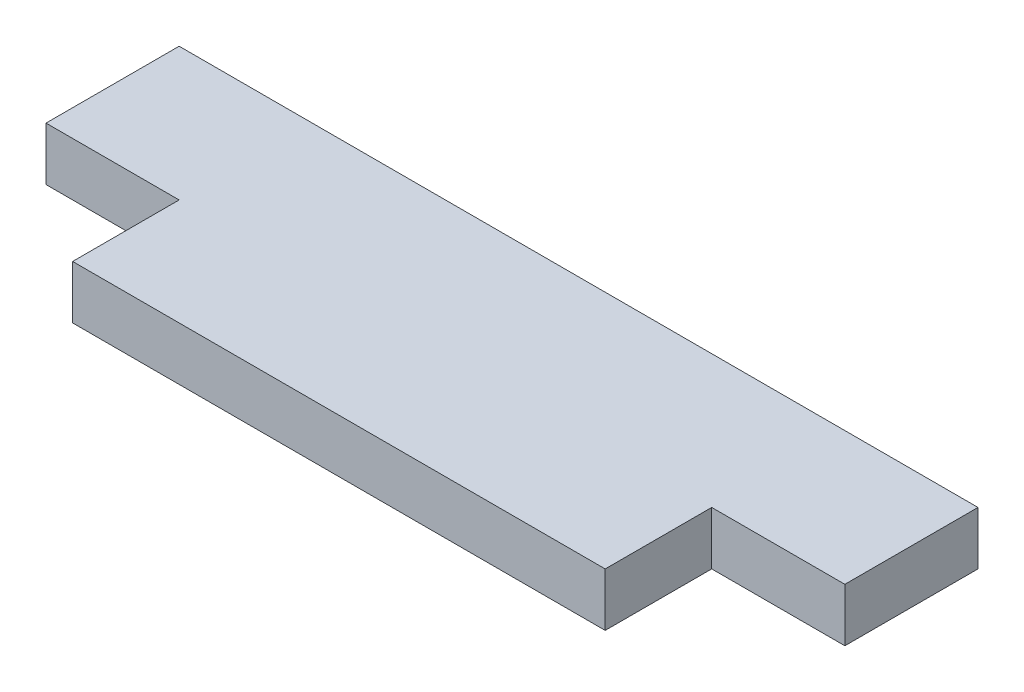
from build123d import *

# Parameters (mm, degrees)
SKETCH1_W           = 20
SKETCH1_H           = 2
BOSS_EXTRUDE1_DEPTH = 4
SKETCH2_W           = 30
SKETCH2_H           = 2
BOSS_EXTRUDE2_DEPTH = 5


with BuildPart() as part:
    # Sketch1 → Boss-Extrude1 (new body)
    with BuildSketch(Plane.XY):
        Rectangle(SKETCH1_W, SKETCH1_H)
    extrude(amount=BOSS_EXTRUDE1_DEPTH)

    # Sketch2 → Boss-Extrude2 (add)
    with BuildSketch(Plane(origin=(0, 0, 0), x_dir=(-1, 0, 0), z_dir=(0, 0, -1))):
        Rectangle(SKETCH2_W, SKETCH2_H)
    extrude(amount=BOSS_EXTRUDE2_DEPTH)


solid = part.part
